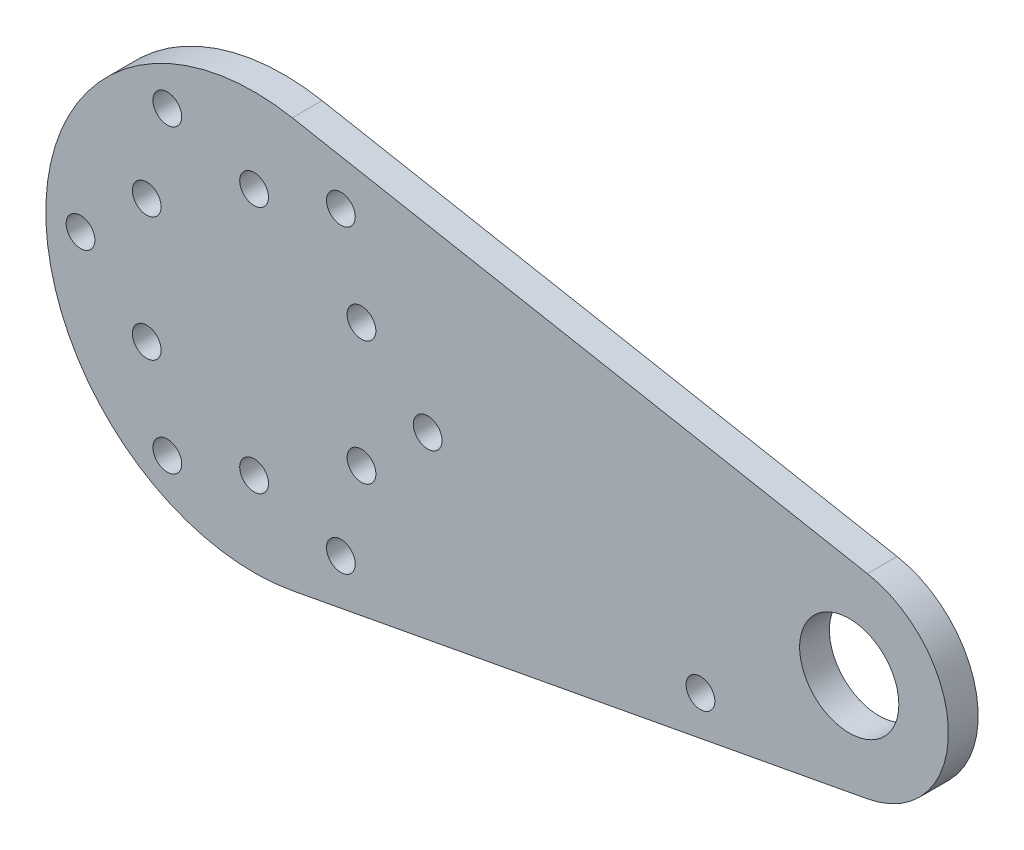
from build123d import *

# Parameters (mm, degrees)
SKETCH_1_R          = 5
SKETCH_1_R_2        = 1.45
EXTRUDE_1_DEPTH     = 3
SKETCH_2_R          = 1.45
CUT_EXTRUDE_1_DEPTH = 74.143694192


with BuildPart() as part:
    # 草图1 → 凸台-拉伸1 (new body)
    with BuildSketch(Plane.XY):
        with BuildLine():
            Line((61.833333333, -9.830508069), (3.85, -20.644066944))
            ThreePointArc((3.85, -20.644066944), (-21, 0), (3.85, 20.644066944))
            Line((3.85, 20.644066944), (61.833333333, 9.830508069))
            ThreePointArc((61.833333333, 9.830508069), (70, 0), (61.833333333, -9.830508069))
        make_face()
        with Locations((60, 0)):
            Circle(SKETCH_1_R, mode=Mode.SUBTRACT)
        with Locations((0, 12.5)):
            Circle(SKETCH_1_R_2, mode=Mode.SUBTRACT)
        with Locations((10.825317547, 6.25)):
            Circle(SKETCH_1_R_2, mode=Mode.SUBTRACT)
        with Locations((10.825317547, -6.25)):
            Circle(SKETCH_1_R_2, mode=Mode.SUBTRACT)
        with Locations((0, -12.5)):
            Circle(SKETCH_1_R_2, mode=Mode.SUBTRACT)
        with Locations((-10.825317547, -6.25)):
            Circle(SKETCH_1_R_2, mode=Mode.SUBTRACT)
        with Locations((-10.825317547, 6.25)):
            Circle(SKETCH_1_R_2, mode=Mode.SUBTRACT)
    extrude(amount=EXTRUDE_1_DEPTH)

    # 草图2 → 切除-拉伸1 (cut, through all)
    with BuildSketch(Plane.XY.offset(3)):
        with Locations((8.75, 15.155444566)):
            Circle(SKETCH_2_R)
        with Locations((17.5, 0)):
            Circle(SKETCH_2_R)
        with Locations((8.75, -15.155444566)):
            Circle(SKETCH_2_R)
        with Locations((-8.75, -15.155444566)):
            Circle(SKETCH_2_R)
        with Locations((-17.5, 0)):
            Circle(SKETCH_2_R)
        with Locations((-8.75, 15.155444566)):
            Circle(SKETCH_2_R)
        with Locations((45, -9)):
            Circle(SKETCH_2_R)
    extrude(amount=-CUT_EXTRUDE_1_DEPTH, mode=Mode.SUBTRACT)


solid = part.part
